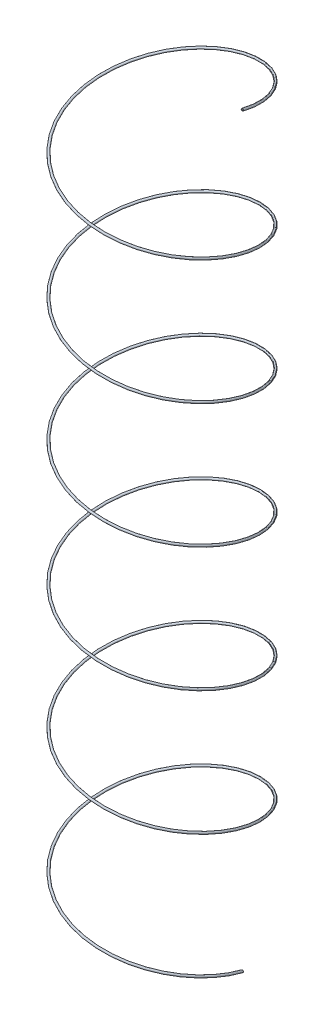
from build123d import *

# Parameters (mm, degrees)
SWEEP_1_PITCH       = 166.3
SWEEP_1_HEIGHT      = 997.8
SWEEP_1_RADIUS      = 107.5
SWEEP_1_START_ANGLE = 90
SKETCH_3_R          = 1.5
SKETCH_3_R_2        = 1.13


with BuildPart() as part:
    # По траектории1: sweep along a helix
    with BuildLine() as sweep_1_path:
        add(Helix(SWEEP_1_PITCH, SWEEP_1_HEIGHT, SWEEP_1_RADIUS, center=(0, 0, 0), direction=(0, 1, 0), lefthand=True, mode=Mode.PRIVATE).rotate(Axis((0, 0, 0), (0, 1, 0)), SWEEP_1_START_ANGLE))
    # Эскиз3 → По траектории1 (sweep)
    with BuildSketch(Plane.XY):
        with Locations((107.5, 0)):
            Circle(SKETCH_3_R)
        with Locations((107.5, 0)):
            Circle(SKETCH_3_R_2, mode=Mode.SUBTRACT)
    sweep(path=sweep_1_path.line, is_frenet=True)


solid = part.part
